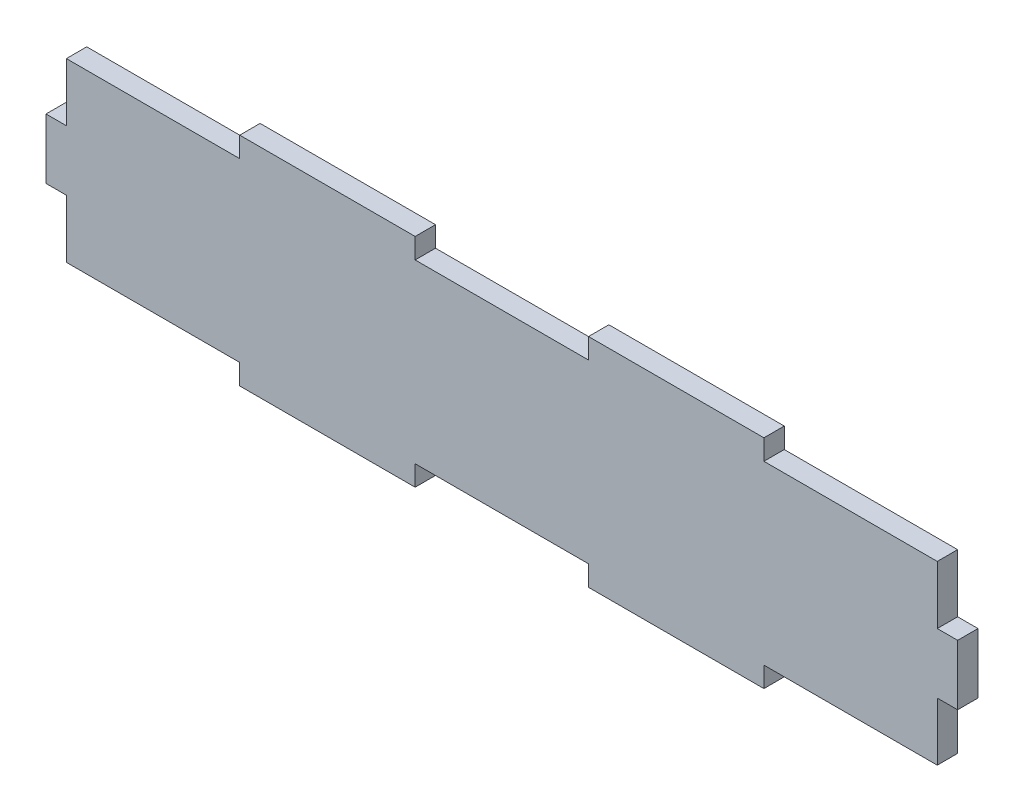
from build123d import *

# Parameters (mm, degrees)
BOSS_EXTRUDE1_DEPTH = 3


with BuildPart() as part:
    # Sketch1 → Boss-Extrude1 (new body)
    with BuildSketch(Plane.XY):
        Polygon((-64.15, -4.433333333), (-67.15, -4.433333333), (-67.15, 4.433333333), (-64.15, 4.433333333), (-64.15, 13), (-38.61, 13), (-38.61, 16), (-12.77, 16), (-12.77, 13), (12.77, 13), (12.77, 16), (38.61, 16), (38.61, 13), (64.15, 13), (64.15, 4.433333333), (67.15, 4.433333333), (67.15, -4.433333333), (64.15, -4.433333333), (64.15, -13), (38.61, -13), (38.61, -16), (12.77, -16), (12.77, -13), (-12.77, -13), (-12.77, -16), (-38.61, -16), (-38.61, -13), (-64.15, -13), align=None)
    extrude(amount=BOSS_EXTRUDE1_DEPTH)


solid = part.part
